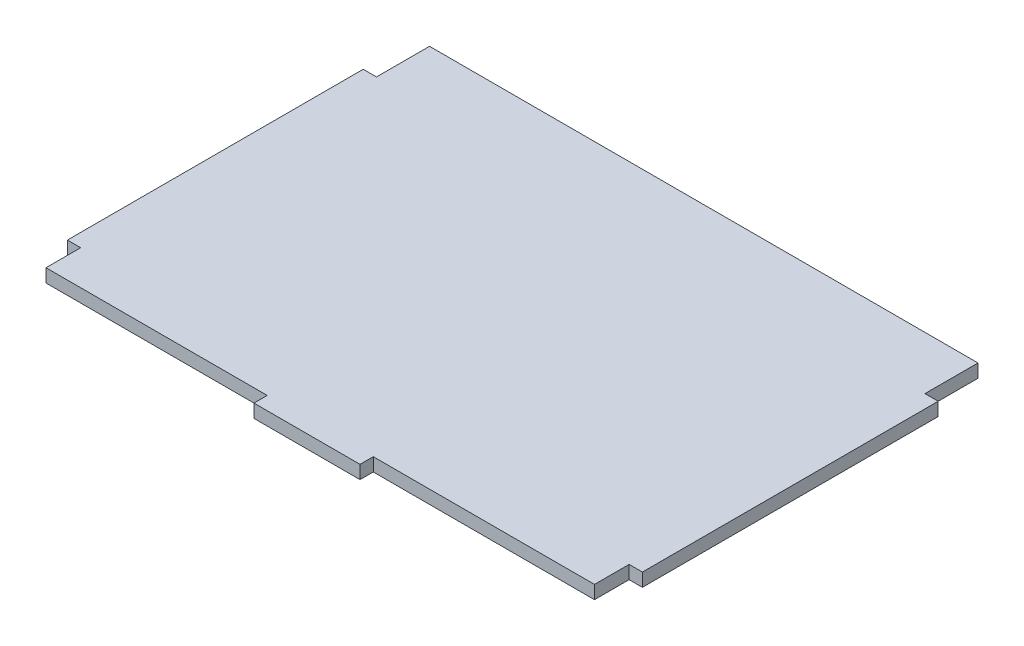
from build123d import *

# Parameters (mm, degrees)
BOSS_EXTRUDE3_DEPTH = 3.175


with BuildPart() as part:
    # Sketch1 → Boss-Extrude3 (new body)
    with BuildSketch(Plane(origin=(0, 0, 0), x_dir=(1, 0, 0), z_dir=(0, 1, 0))):
        Polygon((-65.659, -39.20277551), (-65.659, -47.498), (-12.7, -47.498), (-12.7, -50.673), (12.7, -50.673), (12.7, -47.498), (65.659, -47.498), (65.659, -39.20277551), (68.834, -39.20277551), (68.834, 31.623), (65.659, 31.623), (65.659, 44.323), (-65.659, 44.323), (-65.659, 31.623), (-68.834, 31.623), (-68.834, -39.20277551), align=None)
    extrude(amount=BOSS_EXTRUDE3_DEPTH)


solid = part.part
